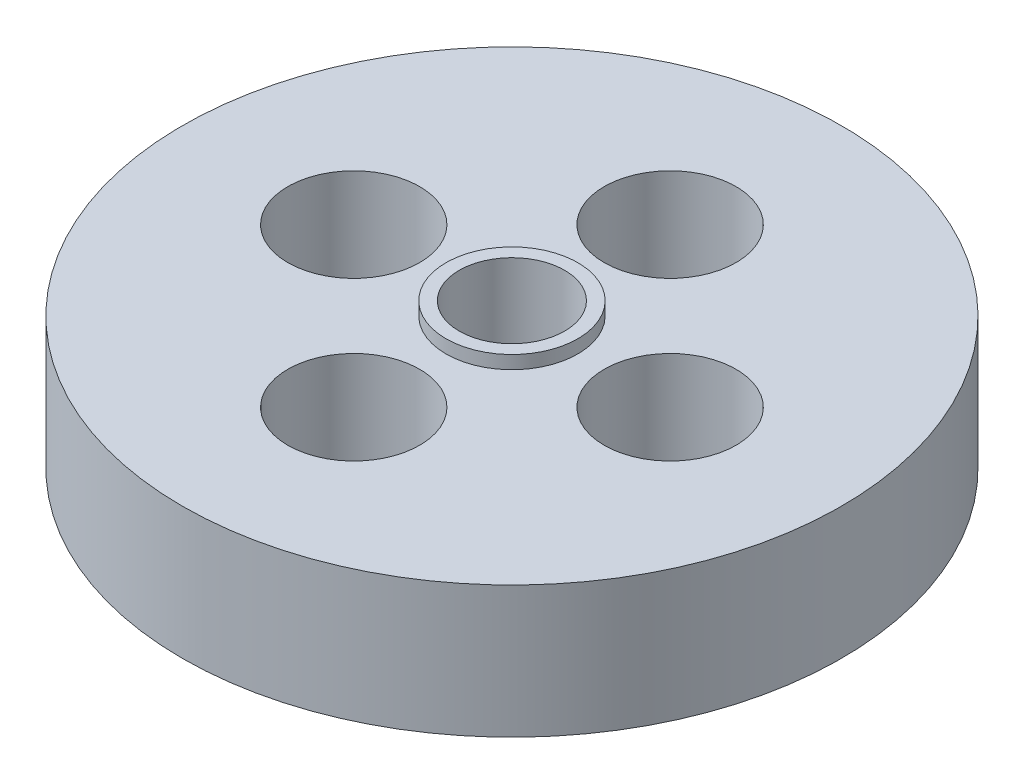
from build123d import *

# Parameters (mm, degrees)
SKETCH1_R           = 25
SKETCH1_R_2         = 4
BOSS_EXTRUDE1_DEPTH = 10
SKETCH2_R           = 5
BOSS_EXTRUDE2_DEPTH = 1
SKETCH3_R           = 4
CUT_EXTRUDE1_DEPTH  = 83


with BuildPart() as part:
    # Sketch1 → Boss-Extrude1 (new body)
    # profile 1 of 2: a face of its own
    with BuildSketch(Plane(origin=(0, 0, 0), x_dir=(1, 0, 0), z_dir=(0, 1, 0))):
        with Locations(Location((0, 0, 0), (0, 0, 270))):
            Circle(SKETCH1_R)
        with BuildLine():
            ThreePointArc((-4.890289414, -10.958333333), (-8.485281374, -8.485281374), (-10.958333333, -4.890289414))
            ThreePointArc((-10.958333333, -4.890289414), (-17, 0), (-10.958333333, 4.890289414))
            ThreePointArc((-10.958333333, 4.890289414), (-8.485281374, 8.485281374), (-4.890289414, 10.958333333))
            ThreePointArc((-4.890289414, 10.958333333), (-0.523714105, 16.97249671), (5, 12))
            ThreePointArc((5, 12), (4.97249671, 11.476285895), (4.890289414, 10.958333333))
            ThreePointArc((4.890289414, 10.958333333), (8.485281374, 8.485281374), (10.958333333, 4.890289414))
            ThreePointArc((10.958333333, 4.890289414), (15.145764348, 3.886407939), (17, 0))
            ThreePointArc((17, 0), (15.145764348, -3.886407939), (10.958333333, -4.890289414))
            ThreePointArc((10.958333333, -4.890289414), (8.485281374, -8.485281374), (4.890289414, -10.958333333))
            ThreePointArc((4.890289414, -10.958333333), (4.97249671, -11.476285895), (5, -12))
            ThreePointArc((5, -12), (-0.523714105, -16.97249671), (-4.890289414, -10.958333333))
        make_face(mode=Mode.SUBTRACT)
    # profile 2 of 2: a face of its own
    with BuildSketch(Plane(origin=(0, 0, 0), x_dir=(1, 0, 0), z_dir=(0, 1, 0))):
        with BuildLine():
            ThreePointArc((-7, 0), (-8.113592061, -3.145764348), (-10.958333333, -4.890289414))
            ThreePointArc((-10.958333333, -4.890289414), (-8.485281374, -8.485281374), (-4.890289414, -10.958333333))
            ThreePointArc((-4.890289414, -10.958333333), (0, -7), (4.890289414, -10.958333333))
            ThreePointArc((4.890289414, -10.958333333), (8.485281374, -8.485281374), (10.958333333, -4.890289414))
            ThreePointArc((10.958333333, -4.890289414), (7, 0), (10.958333333, 4.890289414))
            ThreePointArc((10.958333333, 4.890289414), (8.485281374, 8.485281374), (4.890289414, 10.958333333))
            ThreePointArc((4.890289414, 10.958333333), (0, 7), (-4.890289414, 10.958333333))
            ThreePointArc((-4.890289414, 10.958333333), (-8.485281374, 8.485281374), (-10.958333333, 4.890289414))
            ThreePointArc((-10.958333333, 4.890289414), (-8.113592061, 3.145764348), (-7, 0))
        make_face()
        with Locations(Location((0, 0, 0), (0, 0, 270))):
            Circle(SKETCH1_R_2, mode=Mode.SUBTRACT)
    extrude(amount=BOSS_EXTRUDE1_DEPTH)

    # Sketch2 → Boss-Extrude2 (add)
    with BuildSketch(Plane(origin=(0, 10, 0), x_dir=(1, 0, 0), z_dir=(0, 1, 0))):
        with Locations(Location((0, 0, 0), (0, 0, 270))):
            Circle(SKETCH2_R)
    extrude(amount=BOSS_EXTRUDE2_DEPTH)

    # Sketch3 → Cut-Extrude1 (cut)
    with BuildSketch(Plane.XZ.offset(-10)):
        with Locations(Location((0, 0, 0), (0, 0, 90))):
            Circle(SKETCH3_R)
    extrude(amount=-CUT_EXTRUDE1_DEPTH, mode=Mode.SUBTRACT)


solid = part.part
